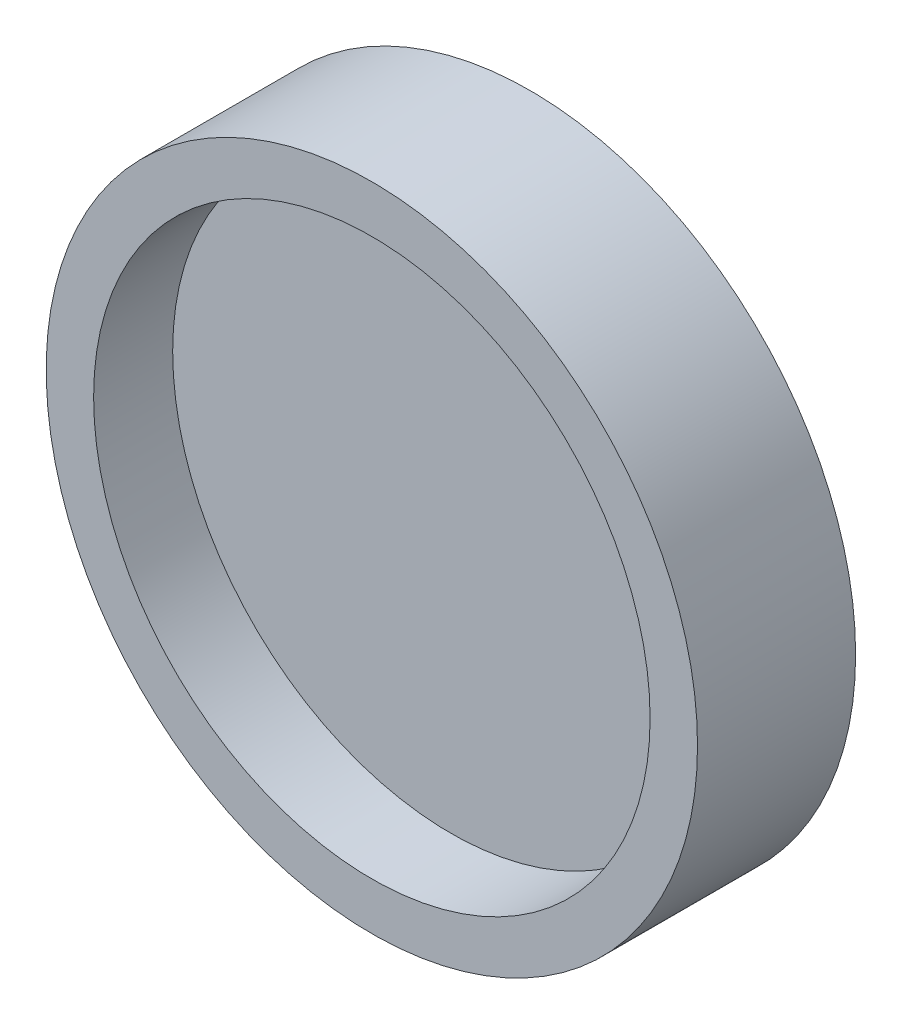
from build123d import *

# Parameters (mm, degrees)
SKETCH_1_R          = 41.2
EXTRUDE_1_DEPTH     = 20
SKETCH_2_R          = 35.2
CUT_EXTRUDE_1_DEPTH = 10


with BuildPart() as part:
    # 草图1 → 凸台-拉伸1 (new body)
    with BuildSketch(Plane.XY):
        Circle(SKETCH_1_R)
    extrude(amount=EXTRUDE_1_DEPTH)

    # 草图2 → 切除-拉伸1 (cut)
    with BuildSketch(Plane.XY.offset(20)):
        Circle(SKETCH_2_R)
    extrude(amount=-CUT_EXTRUDE_1_DEPTH, mode=Mode.SUBTRACT)


solid = part.part
